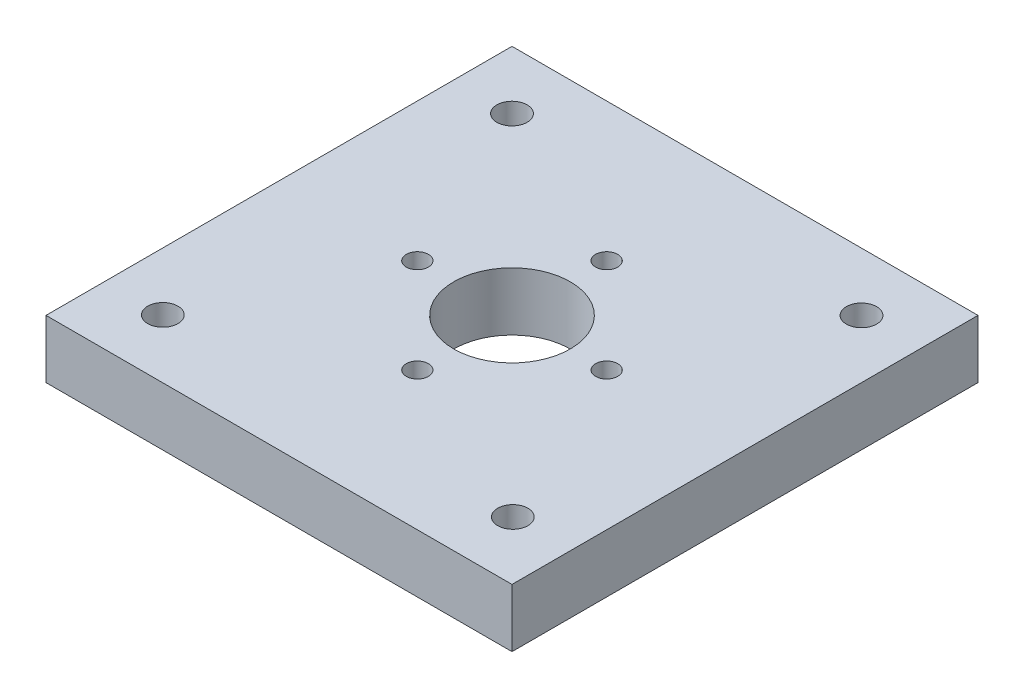
from build123d import *

# Parameters (mm, degrees)
SKETCH2_W           = 101.6
SKETCH2_H           = 101.6
BOSS_EXTRUDE1_DEPTH = 12.7
SKETCH3_R           = 3.302
CUT_EXTRUDE1_DEPTH  = 12.7
SKETCH4_R           = 12.7
CUT_EXTRUDE2_DEPTH  = 12.7
SKETCH5_R           = 2.413
CUT_EXTRUDE3_DEPTH  = 63.5


with BuildPart() as part:
    # Sketch2 → Boss-Extrude1 (new body)
    with BuildSketch(Plane(origin=(0, 0, 0), x_dir=(1, 0, 0), z_dir=(0, 1, 0))):
        Rectangle(SKETCH2_W, SKETCH2_H)
    extrude(amount=BOSS_EXTRUDE1_DEPTH)

    # Sketch3 → Cut-Extrude1 (cut)
    with BuildSketch(Plane(origin=(0, 12.7, 0), x_dir=(1, 0, 0), z_dir=(0, 1, 0))):
        with Locations(Location((-38.1, 38.1, 0), (0, 0, 270))):
            Circle(SKETCH3_R)
        with Locations(Location((-38.15484628, -37.971770083, 0), (0, 0, 90))):
            Circle(SKETCH3_R)
        with Locations(Location((38.15484628, -37.971770083, 0), (0, 0, 270))):
            Circle(SKETCH3_R)
        with Locations(Location((38.1, 38.1, 0), (0, 0, 90))):
            Circle(SKETCH3_R)
    extrude(amount=-CUT_EXTRUDE1_DEPTH, mode=Mode.SUBTRACT)

    # Sketch4 → Cut-Extrude2 (cut)
    with BuildSketch(Plane(origin=(0, 12.7, 0), x_dir=(1, 0, 0), z_dir=(0, 1, 0))):
        with Locations(Location((0, 0, 0), (0, 0, 270))):
            Circle(SKETCH4_R)
    extrude(amount=-CUT_EXTRUDE2_DEPTH, mode=Mode.SUBTRACT)

    # Sketch5 → Cut-Extrude3 (cut)
    with BuildSketch(Plane(origin=(0, 12.7, 0), x_dir=(1, 0, 0), z_dir=(0, 1, 0))):
        with Locations(Location((0, 20.6375, 0), (0, 0, 270))):
            Circle(SKETCH5_R)
        with Locations(Location((20.6375, 0, 0), (0, 0, 270))):
            Circle(SKETCH5_R)
        with Locations(Location((0, -20.6375, 0), (0, 0, 270))):
            Circle(SKETCH5_R)
        with Locations(Location((-20.6375, 0, 0), (0, 0, 270))):
            Circle(SKETCH5_R)
    extrude(amount=-CUT_EXTRUDE3_DEPTH, mode=Mode.SUBTRACT)


solid = part.part
